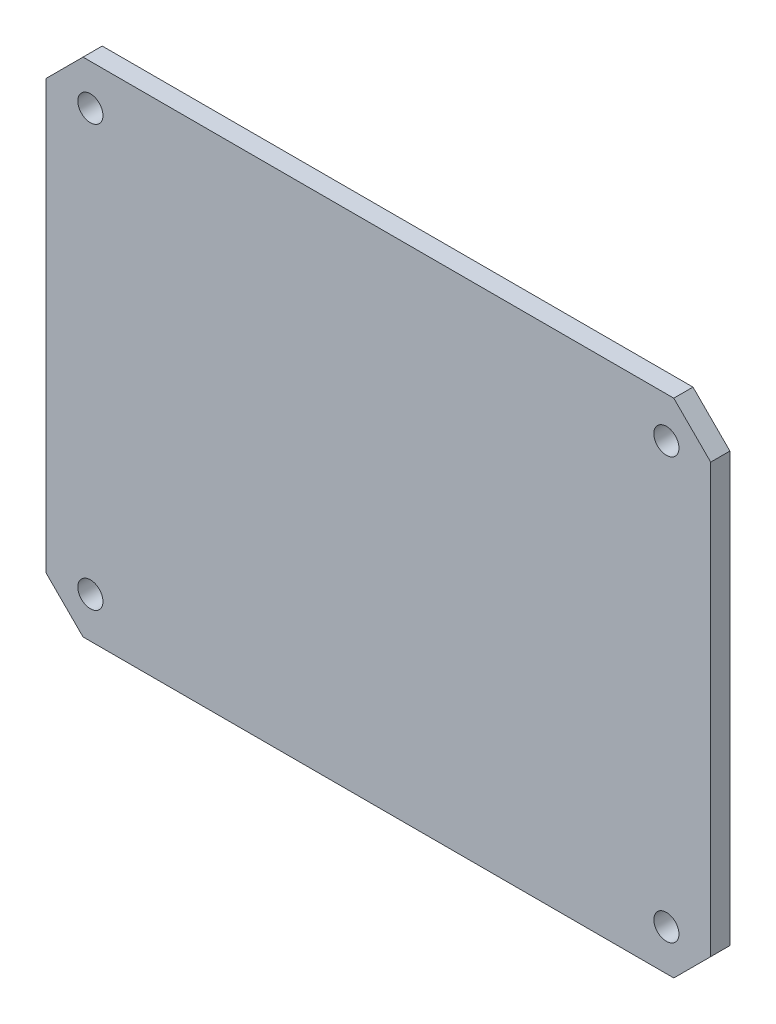
from build123d import *

# Parameters (mm, degrees)
FLAT_COVER_WITH_FOUR_D3_4_CLEARANCES_PRO_R = 1.7
FLAT_COVER_WITH_FOUR_D3_4_CLEARANCES_DEPTH = 2.6


with BuildPart() as part:
    # Flat cover with four D3.4 clearances profile → Flat cover with four D3.4 clearances (new body)
    with BuildSketch(Plane.XY):
        Polygon((-40, -34), (40, -34), (45, -29), (45, 29), (40, 34), (-40, 34), (-45, 29), (-45, -29), align=None)
        with Locations((-39, -28.5)):
            Circle(FLAT_COVER_WITH_FOUR_D3_4_CLEARANCES_PRO_R, mode=Mode.SUBTRACT)
        with Locations((39, -28.5)):
            Circle(FLAT_COVER_WITH_FOUR_D3_4_CLEARANCES_PRO_R, mode=Mode.SUBTRACT)
        with Locations((-39, 28.5)):
            Circle(FLAT_COVER_WITH_FOUR_D3_4_CLEARANCES_PRO_R, mode=Mode.SUBTRACT)
        with Locations((39, 28.5)):
            Circle(FLAT_COVER_WITH_FOUR_D3_4_CLEARANCES_PRO_R, mode=Mode.SUBTRACT)
    extrude(amount=FLAT_COVER_WITH_FOUR_D3_4_CLEARANCES_DEPTH)


solid = part.part
